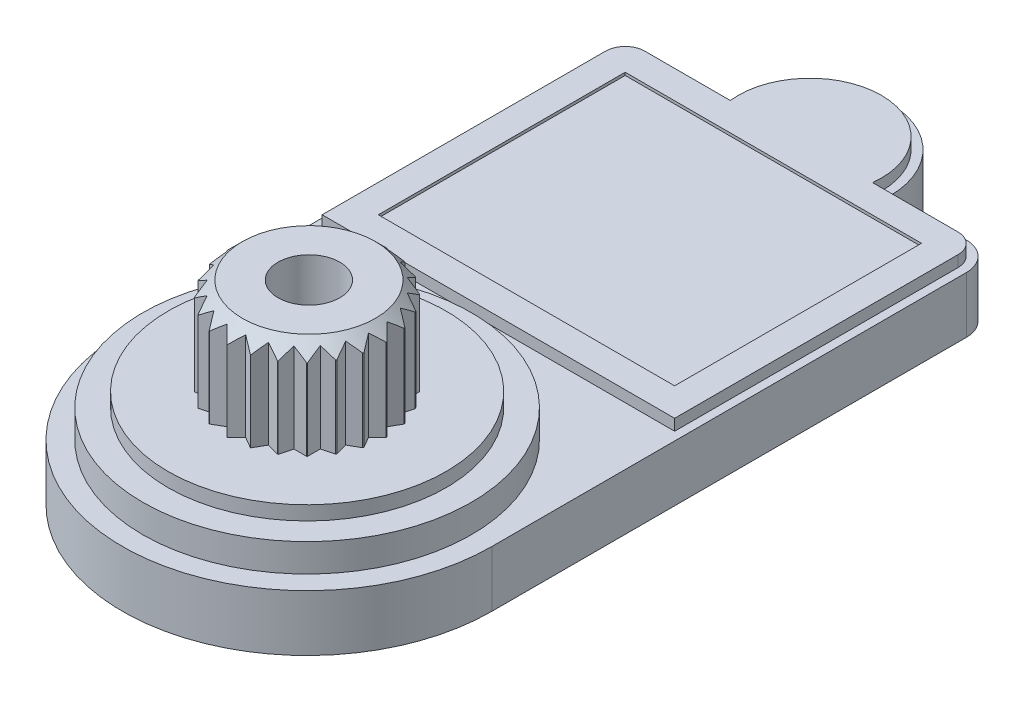
from build123d import *

# Parameters (mm, degrees)
SKETCH1_R           = 6.575
SKETCH1_R_2         = 1
BOSS_EXTRUDE1_DEPTH = 2
SKETCH2_R           = 5.85
BOSS_EXTRUDE2_DEPTH = 1
SKETCH3_R           = 4.95
BOSS_EXTRUDE3_DEPTH = 0.5
BOSS_EXTRUDE4_DEPTH = 3.4
SKETCH6_R           = 1.1
CUT_EXTRUDE1_DEPTH  = 4
BOSS_EXTRUDE5_DEPTH = 0.4
SKETCH8_W           = 10.55
SKETCH8_H           = 8.790176683
CUT_EXTRUDE2_DEPTH  = 0.1


with BuildPart() as part:
    # Sketch1 → Boss-Extrude1 (new body)
    with BuildSketch(Plane(origin=(0, 0, 0), x_dir=(1, 0, 0), z_dir=(0, 1, 0))):
        with Locations((0, -7.9)):
            Circle(SKETCH1_R)
        with BuildLine():
            Line((-2.85, 10), (-5.575, 10))
            ThreePointArc((-5.575, 10), (-4.867893219, 9.707106781), (-4.575, 9))
            ThreePointArc((-4.575, 9), (-5.574999999, 8), (-6.575, 8.999999999))
            Line((-6.575, 8.999999999), (-6.575, -7.9))
            ThreePointArc((-6.575, -7.9), (0, -1.325), (6.575, -7.9))
            Line((6.575, -7.9), (6.575, 9))
            ThreePointArc((6.575, 9), (4.867893224, 8.292893214), (5.574999986, 10))
            Line((5.574999986, 10), (2.85, 10))
            ThreePointArc((2.85, 10), (0, 7.15), (-2.85, 10))
        make_face()
        with Locations((-5.575, 9)):
            Circle(SKETCH1_R_2)
        with BuildLine():
            ThreePointArc((2.85, 10), (0, 12.85), (-2.85, 10))
            Line((-2.85, 10), (2.85, 10))
        make_face()
        with BuildLine():
            Line((2.85, 10), (-2.85, 10))
            ThreePointArc((-2.85, 10), (0, 7.15), (2.85, 10))
        make_face()
        with Locations((5.575, 9)):
            Circle(SKETCH1_R_2)
    extrude(amount=BOSS_EXTRUDE1_DEPTH)

    # Sketch2 → Boss-Extrude2 (add)
    with BuildSketch(Plane(origin=(0, 2, 0), x_dir=(-1, 0, 0), z_dir=(0, 1, 0))):
        with Locations(Location((0, 7.9, 0), (0, 0, 90))):
            Circle(SKETCH2_R)
    extrude(amount=BOSS_EXTRUDE2_DEPTH)

    # Sketch3 → Boss-Extrude3 (add)
    with BuildSketch(Plane(origin=(0, 3, 0), x_dir=(-1, 0, 0), z_dir=(0, 1, 0))):
        with Locations(Location((0, 7.9, 0), (0, 0, 90))):
            Circle(SKETCH3_R)
    extrude(amount=BOSS_EXTRUDE3_DEPTH)

    # Sketch4 → Boss-Extrude4 (add)
    with BuildSketch(Plane(origin=(0, 3.5, 0), x_dir=(-1, 0, 0), z_dir=(0, 1, 0))):
        Polygon((2.736417755, 7.190894071), (2.518440958, 7.568440958), (2.831329546, 7.881329546), (2.828587818, 7.921412182), (2.518440958, 8.231559042), (2.741390732, 8.617719379), (2.729517437, 8.651127629), (2.346813369, 8.872081926), (2.463209043, 9.306476495), (2.445926072, 9.330960886), (2.015254326, 9.446359032), (2.015254326, 9.900296057), (1.996868143, 9.915254326), (1.546359032, 9.915254326), (1.427678707, 10.35817533), (1.412422166, 10.36480218), (0.972081926, 10.246813369), (0.740314632, 10.648246096), (0.731654815, 10.64943636), (0.331559042, 10.418440958), (0, 10.75), (-0.331559042, 10.418440958), (-0.731654815, 10.64943636), (-0.740314632, 10.648246096), (-0.972081926, 10.246813369), (-1.412422166, 10.36480218), (-1.427678707, 10.35817533), (-1.546359032, 9.915254326), (-1.996868143, 9.915254326), (-2.015254326, 9.900296057), (-2.015254326, 9.446359032), (-2.445926072, 9.330960886), (-2.463209043, 9.306476495), (-2.346813369, 8.872081926), (-2.729517437, 8.651127629), (-2.741390732, 8.617719379), (-2.518440958, 8.231559042), (-2.828587818, 7.921412182), (-2.831329546, 7.881329546), (-2.518440958, 7.568440958), (-2.736417755, 7.190894071), (-2.727435802, 7.147670539), (-2.346813369, 6.927918074), (-2.459115706, 6.508800044), (-2.437318125, 6.466732622), (-2.015254326, 6.353640968), (-2.015254326, 5.921202275), (-1.981206238, 5.884745674), (-1.546359032, 5.884745674), (-1.434668452, 5.467910755), (-1.390523426, 5.441065569), (-0.972081926, 5.553186631), (-0.756489757, 5.179770042), (-0.705710775, 5.165542438), (-0.331559042, 5.381559042), (-0.026545054, 5.076545054), (0.026545054, 5.076545054), (0.331559042, 5.381559042), (0.705710775, 5.165542438), (0.756489757, 5.179770042), (0.972081926, 5.553186631), (1.390523426, 5.441065569), (1.434668452, 5.467910755), (1.546359032, 5.884745674), (1.981206238, 5.884745674), (2.015254326, 5.921202275), (2.015254326, 6.353640968), (2.437318125, 6.466732622), (2.459115706, 6.508800044), (2.346813369, 6.927918074), (2.727435802, 7.147670539), align=None)
    extrude(amount=BOSS_EXTRUDE4_DEPTH)

    # Sketch5 → Cut-Revolve1 (revolve, cut)
    with BuildSketch(Plane(origin=(0, 0, 0), x_dir=(0, 0, -1), z_dir=(1, 0, 0)), mode=Mode.PRIVATE) as cut_revolve1_sk:
        Polygon((-5.867221225, 7.3), (-4.517199782, 7.3), (-4.517199782, 5.949978558), align=None)
    revolve(cut_revolve1_sk.sketch.rotate(Axis((0, 8.077813164, 7.836091173), (0, -1, 0)), 359.448868655), axis=Axis((0, 8.077813164, 7.836091173), (0, -1, 0)), mode=Mode.SUBTRACT)

    # Sketch6 → Cut-Extrude1 (cut)
    with BuildSketch(Plane(origin=(0, 6.9, 0), x_dir=(-1, 0, 0), z_dir=(0, 1, 0))):
        with Locations(Location((0, 7.836091173, 0), (0, 0, 90))):
            Circle(SKETCH6_R)
    extrude(amount=-CUT_EXTRUDE1_DEPTH, mode=Mode.SUBTRACT)

    # Sketch7 → Boss-Extrude5 (add)
    with BuildSketch(Plane(origin=(0, 2, 0), x_dir=(-1, 0, 0), z_dir=(0, 1, 0))):
        with BuildLine():
            Line((2.532291452, -9.7), (5.575, -9.7))
            ThreePointArc((5.575, -9.7), (6.069974747, -9.494974747), (6.275, -9))
            Line((6.275, -9), (6.275, 1.090176683))
            Line((6.275, 1.090176683), (-6.275, 1.090176683))
            Line((-6.275, 1.090176683), (-6.275, -1.654552581))
            Line((-6.275, -1.654552581), (-6.275, -9))
            ThreePointArc((-6.275, -9), (-6.069974747, -9.494974747), (-5.575, -9.7))
            Line((-5.575, -9.7), (-2.532291452, -9.7))
            ThreePointArc((-2.532291452, -9.7), (0, -12.55), (2.532291452, -9.7))
        make_face()
    extrude(amount=BOSS_EXTRUDE5_DEPTH)

    # Sketch8 → Cut-Extrude2 (cut)
    with BuildSketch(Plane(origin=(0, 2.4, 0), x_dir=(-1, 0, 0), z_dir=(0, 1, 0))):
        with Locations((0, -4.304911659)):
            Rectangle(SKETCH8_W, SKETCH8_H)
    extrude(amount=-CUT_EXTRUDE2_DEPTH, mode=Mode.SUBTRACT)


solid = part.part
